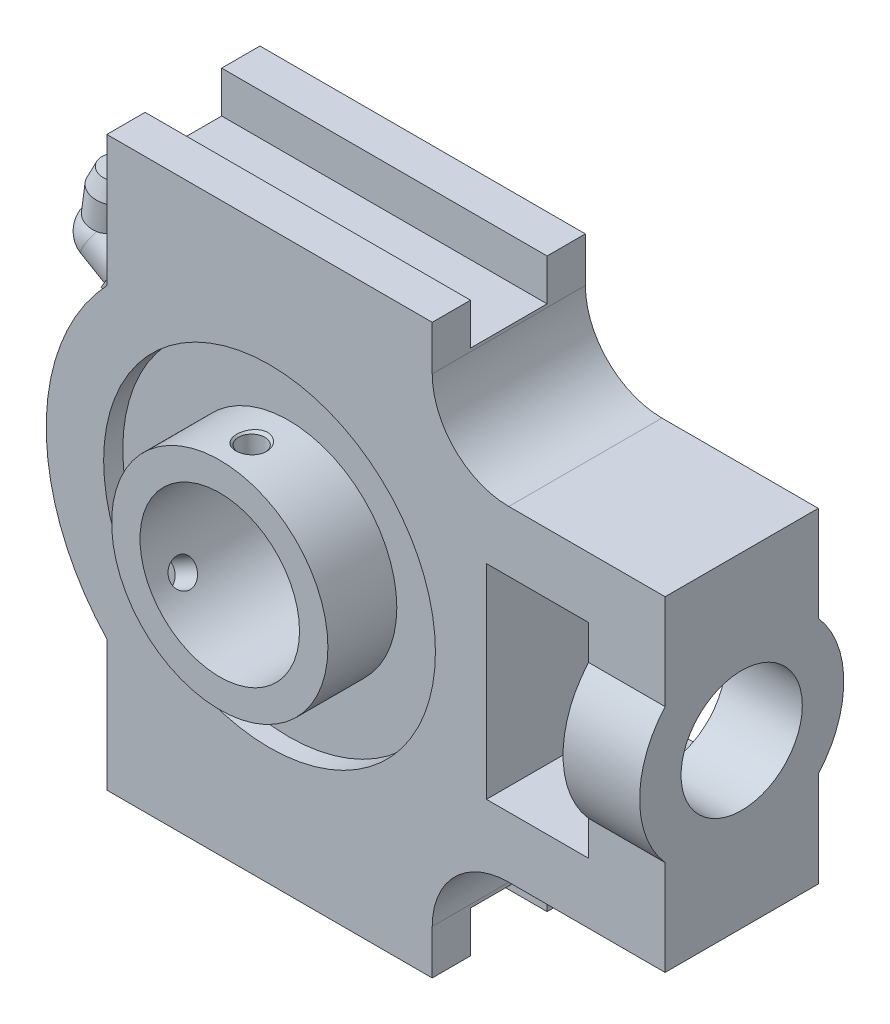
from build123d import *

# Parameters (mm, degrees)
CUT_EXTRUDE1_DEPTH       = 4
CUT_EXTRUDE1_DEPTH_BACK  = 4
SKETCH2_R                = 5.5
BOSS_EXTRUDE1_DEPTH      = 12
BOSS_EXTRUDE1_DEPTH_BACK = 12
SKETCH4_W                = 16
SKETCH4_H                = 32
SKETCH5_R                = 16
SKETCH5_R_2              = 9.5
BOSS_EXTRUDE2_DEPTH      = 12
SKETCH6_R                = 9.5
CUT_EXTRUDE2_DEPTH       = 12
CUT_EXTRUDE3_DEPTH       = 51
CUT_EXTRUDE3_DEPTH_BACK  = 51
SKETCH7_W                = 12
SKETCH7_H                = 7.5
CUT_EXTRUDE4_DEPTH       = 51
CUT_EXTRUDE4_DEPTH_BACK  = 51
SKETCH8_W                = 12
SKETCH8_H                = 7.5
SKETCH9_W                = 34.1
SKETCH9_H                = 26


with BuildPart() as part:
    # Sketch1 → Revolve1 (revolve)
    with BuildSketch(Plane(origin=(0, 0, 0), x_dir=(0.8660254037844387, -0.4999999999999999, 0), z_dir=(0.49999999999999994, 0.8660254037844388, 0)), mode=Mode.PRIVATE) as revolve1_sk:
        with BuildLine():
            Line((-41.5, 2.8), (-37, 2.8))
            Line((-37, 2.8), (-37, 3.8))
            Line((-37, 3.8), (-34.5, 3.8))
            Line((-34.5, 3.8), (-34.5, -1.2))
            Line((-34.5, -1.2), (-45.5, -1.2))
            ThreePointArc((-45.5, -1.2), (-44.328427125, 1.628427125), (-41.5, 2.8))
        make_face()
    revolve(revolve1_sk.sketch.rotate(Axis((-29.877876431, 17.25, 1.2), (-0.8660254037844386, 0.5000000000000001, 0)), 90), axis=Axis((-29.877876431, 17.25, 1.2), (-0.8660254037844386, 0.5000000000000001, 0)))

    # Sketch2 → Cut-Extrude1 (cut, two sides: drawn at the far end of the back side and taken through both)
    with BuildSketch(Plane(origin=(-30.310889132, 17.5, 0), x_dir=(0, 0, -1), z_dir=(0.8660254037844385, -0.5000000000000003, 0)).offset(-CUT_EXTRUDE1_DEPTH_BACK)):
        with Locations((-1.2, 0)):
            Circle(SKETCH2_R)
        Polygon((-5.2, -2.309401077), (-1.2, -4.618802154), (2.8, -2.309401077), (2.8, 2.309401077), (-1.2, 4.618802154), (-5.2, 2.309401077), align=None, mode=Mode.SUBTRACT)
    extrude(amount=CUT_EXTRUDE1_DEPTH + CUT_EXTRUDE1_DEPTH_BACK, mode=Mode.SUBTRACT)

    # Sketch3 → Revolve2 (revolve)
    with BuildSketch(Plane(origin=(-38.012988024, 5.004504814, 0), x_dir=(0, 0, -1), z_dir=(0.9914448613738105, -0.13052619222005157, 0)), mode=Mode.PRIVATE) as revolve2_sk:
        Polygon((-1.2, 15.881362443), (-4.5, 15.881362443), (-4.5, 22.481362443), (-3.6, 25.181362443), (-1.2, 25.181362443), align=None)
    revolve(revolve2_sk.sketch.rotate(Axis((-34.726160669, 29.970437211, 1.2), (-0.1305261922200517, -0.9914448613738104, 0)), 270), axis=Axis((-34.726160669, 29.970437211, 1.2), (-0.1305261922200517, -0.9914448613738104, 0)))

    # Sketch4 → Boss-Extrude1 (add, two sides: drawn at the far end of the back side and taken through both)
    with BuildSketch(Plane.XY.offset(-BOSS_EXTRUDE1_DEPTH_BACK)):
        with BuildLine():
            Line((-25.5, -23.973944189), (-25.5, -44.5))
            Line((-25.5, -44.5), (25.5, -44.5))
            Line((25.5, -44.5), (25.5, -37.5))
            ThreePointArc((25.5, -37.5), (29.014718626, -29.014718626), (37.5, -25.5))
            Line((37.5, -25.5), (62, -25.5))
            Line((62, -25.5), (62, 25.5))
            Line((62, 25.5), (37.5, 25.5))
            ThreePointArc((37.5, 25.5), (29.014718626, 29.014718626), (25.5, 37.5))
            Line((25.5, 37.5), (25.5, 44.5))
            Line((25.5, 44.5), (-25.5, 44.5))
            Line((-25.5, 44.5), (-25.5, 23.973944189))
            ThreePointArc((-25.5, 23.973944189), (-35, 0), (-25.5, -23.973944189))
        make_face()
        with Locations((42, 0)):
            Rectangle(SKETCH4_W, SKETCH4_H, mode=Mode.SUBTRACT)
    extrude(amount=BOSS_EXTRUDE1_DEPTH + BOSS_EXTRUDE1_DEPTH_BACK)

    # Sketch5 → Boss-Extrude2 (add)
    with BuildSketch(Plane(origin=(62, 0, 0), x_dir=(0, 0, -1), z_dir=(1, 0, 0))):
        Circle(SKETCH5_R)
        Circle(SKETCH5_R_2, mode=Mode.SUBTRACT)
    extrude(amount=-BOSS_EXTRUDE2_DEPTH)

    # Sketch6 → Cut-Extrude2 (cut)
    with BuildSketch(Plane(origin=(62, 0, 0), x_dir=(0, 0, -1), z_dir=(1, 0, 0))):
        Circle(SKETCH6_R)
    extrude(amount=-CUT_EXTRUDE2_DEPTH, mode=Mode.SUBTRACT)

    # Sketch7 → Cut-Extrude3 (cut, two sides: drawn at the far end of the back side and taken through both)
    with BuildSketch(Plane(origin=(25.5, 0, 0), x_dir=(0, 0, -1), z_dir=(1, 0, 0)).offset(-CUT_EXTRUDE3_DEPTH_BACK)):
        with Locations((0, 41.75)):
            Rectangle(SKETCH7_W, SKETCH7_H)
    extrude(amount=CUT_EXTRUDE3_DEPTH + CUT_EXTRUDE3_DEPTH_BACK, mode=Mode.SUBTRACT)

    # Sketch8 → Cut-Extrude4 (cut, two sides: drawn at the far end of the back side and taken through both)
    with BuildSketch(Plane(origin=(25.5, 0, 0), x_dir=(0, 0, -1), z_dir=(1, 0, 0)).offset(-CUT_EXTRUDE4_DEPTH_BACK)):
        with Locations((0, -41.75)):
            Rectangle(SKETCH8_W, SKETCH8_H)
    extrude(amount=CUT_EXTRUDE4_DEPTH + CUT_EXTRUDE4_DEPTH_BACK, mode=Mode.SUBTRACT)

    # Sketch9 → Cut-Revolve1 (revolve, cut)
    with BuildSketch(Plane(origin=(0, 0, 0), x_dir=(0, 0, -1), z_dir=(1, 0, 0)), mode=Mode.PRIVATE) as cut_revolve1_sk:
        with Locations((-2.75, 13)):
            Rectangle(SKETCH9_W, SKETCH9_H)
    revolve(cut_revolve1_sk.sketch.rotate(Axis((0, 0, -14.3), (0, 0, 1)), 270), axis=Axis((0, 0, -14.3), (0, 0, 1)), mode=Mode.SUBTRACT)

    # Sketch10 → Revolve3 (revolve)
    with BuildSketch(Plane(origin=(0, 0, 0), x_dir=(0, 0, -1), z_dir=(1, 0, 0)), mode=Mode.PRIVATE) as revolve3_sk:
        Polygon((-19.8, 12.5), (14.3, 12.5), (14.3, 16.95), (9, 16.95), (9, 26), (-9, 26), (-9, 16.95), (-19.8, 16.95), align=None)
    revolve(revolve3_sk.sketch.rotate(Axis((0, 0, -50), (0, 0, 1)), 270), axis=Axis((0, 0, -50), (0, 0, 1)))

    # Sketch11 → Cut-Revolve2 (revolve, cut)
    with BuildSketch(Plane.XY.offset(14.8), mode=Mode.PRIVATE) as cut_revolve2_sk:
        Polygon((0, 16.95), (2.5, 16.95), (2.067, 16.517), (2.067, 0), (0, 0), align=None)
    revolve(cut_revolve2_sk.sketch.rotate(Axis((0, 0, 14.8), (0, 1, 0)), 270), axis=Axis((0, 0, 14.8), (0, 1, 0)), mode=Mode.SUBTRACT)

    # Sketch12 → Cut-Revolve3 (revolve, cut)
    with BuildSketch(Plane.XY.offset(14.8), mode=Mode.PRIVATE) as cut_revolve3_sk:
        Polygon((-14.679130594, -8.475), (-15.929130594, -6.309936491), (-15.337641594, -6.46842549), (-1.0335, 1.79007451), (0, 0), align=None)
    revolve(cut_revolve3_sk.sketch.rotate(Axis((0, 0, 14.8), (-0.8660254037844382, -0.5000000000000009, 0)), 180), axis=Axis((0, 0, 14.8), (-0.8660254037844382, -0.5000000000000009, 0)), mode=Mode.SUBTRACT)


solid = part.part
